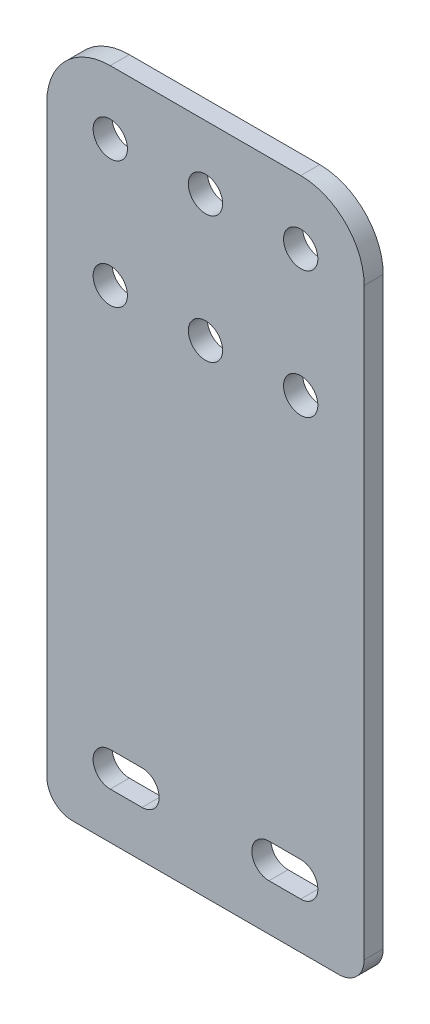
from build123d import *

# Parameters (mm, degrees)
MODEL_R                         = 2.7
AUFSATZ_LINEAR_AUSTRAGEN1_DEPTH = 3


with BuildPart() as part:
    # Model → Aufsatz-Linear austragen1 (new body)
    with BuildSketch(Plane.XY):
        with BuildLine():
            Line((40, 106), (10, 106))
            ThreePointArc((10, 106), (2.928932188, 103.071067812), (0, 96))
            Line((0, 96), (0, 4))
            ThreePointArc((0, 4), (1.171572875, 1.171572875), (4, 0))
            Line((4, 0), (46, 0))
            ThreePointArc((46, 0), (48.828427125, 1.171572875), (50, 4))
            Line((50, 4), (50, 96))
            ThreePointArc((50, 96), (47.071067812, 103.071067812), (40, 106))
        make_face()
        with Locations((25, 76)):
            Circle(MODEL_R, mode=Mode.SUBTRACT)
        with Locations((25, 96)):
            Circle(MODEL_R, mode=Mode.SUBTRACT)
        with Locations((40, 76)):
            Circle(MODEL_R, mode=Mode.SUBTRACT)
        with Locations((40, 96)):
            Circle(MODEL_R, mode=Mode.SUBTRACT)
        with Locations((10, 76)):
            Circle(MODEL_R, mode=Mode.SUBTRACT)
        with Locations((10, 96)):
            Circle(MODEL_R, mode=Mode.SUBTRACT)
        with BuildLine():
            Line((15, 7.3), (10, 7.3))
            ThreePointArc((10, 7.3), (7.3, 10), (10, 12.7))
            Line((10, 12.7), (15, 12.7))
            ThreePointArc((15, 12.7), (17.7, 10), (15, 7.3))
        make_face(mode=Mode.SUBTRACT)
        with BuildLine():
            Line((40, 7.3), (35, 7.3))
            ThreePointArc((35, 7.3), (32.3, 10), (35, 12.7))
            Line((35, 12.7), (40, 12.7))
            ThreePointArc((40, 12.7), (42.7, 10), (40, 7.3))
        make_face(mode=Mode.SUBTRACT)
    extrude(amount=AUFSATZ_LINEAR_AUSTRAGEN1_DEPTH)


solid = part.part
